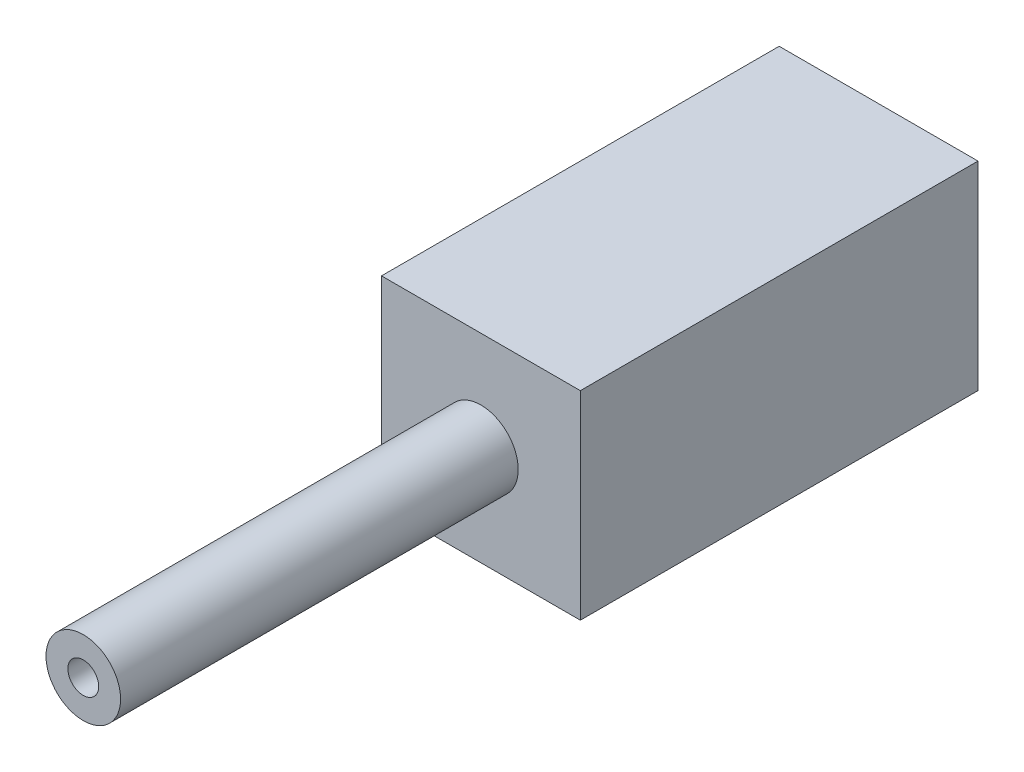
from build123d import *

# Parameters (mm, degrees)
SKETCH1_W           = 20
SKETCH1_H           = 20
SKETCH1_R           = 1.55
BOSS_EXTRUDE1_DEPTH = 40
SKETCH2_R           = 3.75
SKETCH2_R_2         = 1.55
BOSS_EXTRUDE2_DEPTH = 40


with BuildPart() as part:
    # Sketch1 → Boss-Extrude1 (new body)
    with BuildSketch(Plane.XY):
        Rectangle(SKETCH1_W, SKETCH1_H)
        Circle(SKETCH1_R, mode=Mode.SUBTRACT)
    extrude(amount=BOSS_EXTRUDE1_DEPTH)

    # Sketch2 → Boss-Extrude2 (add)
    with BuildSketch(Plane.XY.offset(40)):
        Circle(SKETCH2_R)
        Circle(SKETCH2_R_2, mode=Mode.SUBTRACT)
    extrude(amount=BOSS_EXTRUDE2_DEPTH)


solid = part.part
